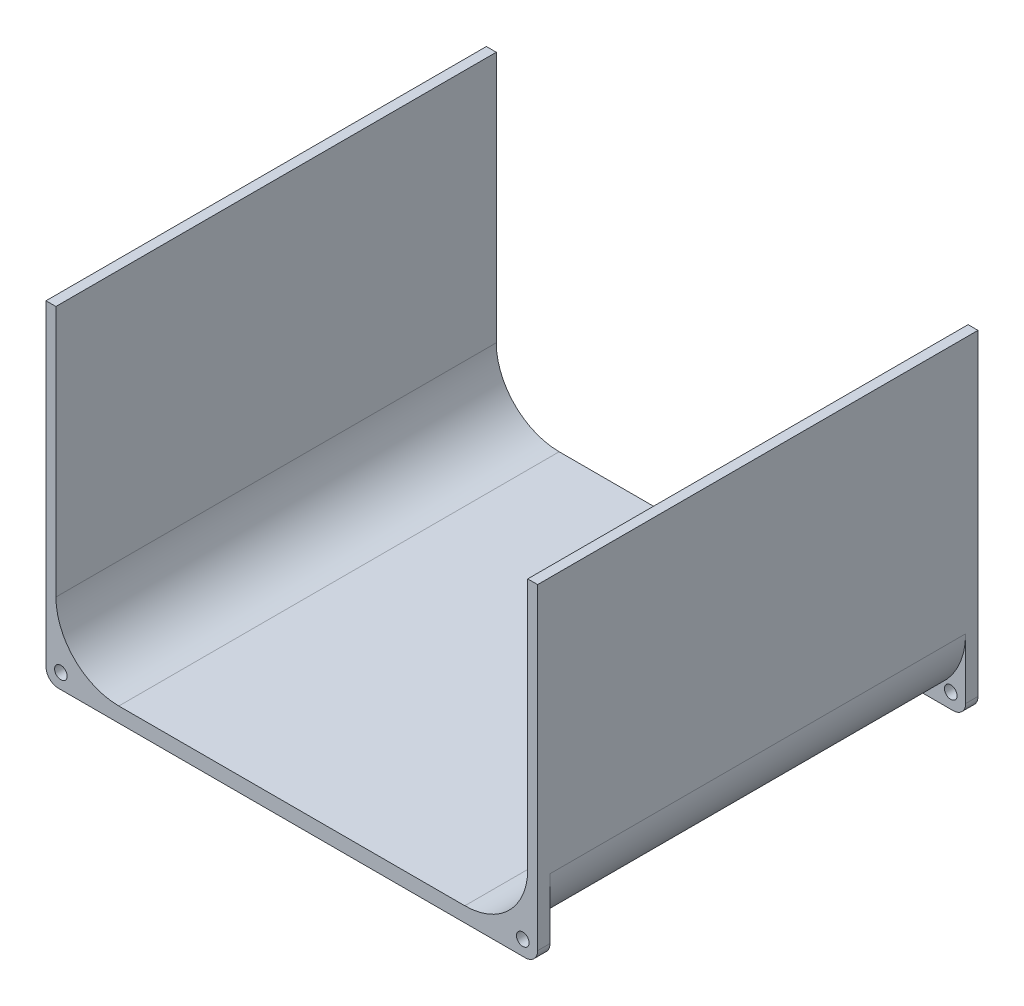
from build123d import *

# Parameters (mm, degrees)
BOSS_EXTRUDE1_DEPTH = 177.8
BOSS_EXTRUDE2_DEPTH = 5
FILLET1_R           = 5
BOSS_EXTRUDE3_DEPTH = 5
FILLET2_R           = 5
BOSS_EXTRUDE4_DEPTH = 5
FILLET3_R           = 5
BOSS_EXTRUDE5_DEPTH = 5
FILLET4_R           = 5
SKETCH6_R           = 2.54
CUT_EXTRUDE1_DEPTH  = 177.8
SKETCH7_R           = 2.54
CUT_EXTRUDE2_DEPTH  = 177.8
SKETCH9_W           = 2.564423076
SKETCH9_H           = 1.234722222
BOSS_EXTRUDE6_DEPTH = 0.8


with BuildPart() as part:
    # Sketch1 → Boss-Extrude1 (new body)
    with BuildSketch(Plane.XY):
        with BuildLine():
            Line((86.99009901, 50.581683168), (90.99009901, 50.581683168))
            Line((90.99009901, 50.581683168), (90.99009901, -53.018316832))
            ThreePointArc((90.99009901, -53.018316832), (82.379038377, -73.807256199), (61.59009901, -82.418316832))
            Line((61.59009901, -82.418316832), (-78.10990099, -82.418316832))
            ThreePointArc((-78.10990099, -82.418316832), (-98.898840357, -73.807256199), (-107.50990099, -53.018316832))
            Line((-107.50990099, -53.018316832), (-107.50990099, 50.581683168))
            Line((-107.50990099, 50.581683168), (-103.50990099, 50.581683168))
            Line((-103.50990099, 50.581683168), (-103.50990099, -51.018316832))
            ThreePointArc((-103.50990099, -51.018316832), (-96.070413232, -68.978829074), (-78.10990099, -76.418316832))
            Line((-78.10990099, -76.418316832), (61.59009901, -76.418316832))
            ThreePointArc((61.59009901, -76.418316832), (79.550611252, -68.978829074), (86.99009901, -51.018316832))
            Line((86.99009901, -51.018316832), (86.99009901, 50.581683168))
        make_face()
    extrude(amount=BOSS_EXTRUDE1_DEPTH)

    # Sketch2 → Boss-Extrude2 (add)
    with BuildSketch(Plane.XY.offset(177.8)):
        Polygon((-107.50990099, -53.018316832), (-101.343905839, -67.718316832), (-91.167595332, -76.919981805), (-78.10990099, -82.418316832), (-107.50990099, -82.418316832), align=None)
    extrude(amount=-BOSS_EXTRUDE2_DEPTH)

    # Fillet1
    fillet1_edges = [part.edges().sort_by_distance(p)[0] for p in [
        (-107.50990099, -82.418316832, 175.3),
    ]]
    fillet(fillet1_edges, radius=FILLET1_R)

    # Sketch3 → Boss-Extrude3 (add)
    with BuildSketch(Plane.XY.offset(177.8)):
        Polygon((90.99009901, -53.018316832), (82.7127388, -69.049550828), (67.334590357, -78.639336426), (61.59009901, -82.418316832), (90.99009901, -82.418316832), align=None)
    extrude(amount=-BOSS_EXTRUDE3_DEPTH)

    # Fillet2
    fillet2_edges = [part.edges().sort_by_distance(p)[0] for p in [
        (90.99009901, -82.418316832, 175.3),
    ]]
    fillet(fillet2_edges, radius=FILLET2_R)

    # Sketch4 → Boss-Extrude4 (add)
    with BuildSketch(Plane(origin=(0, 0, 0), x_dir=(-1, 0, 0), z_dir=(0, 0, -1))):
        Polygon((-90.99009901, -53.018316832), (-84.038583337, -68.805509364), (-61.59009901, -82.418316832), (-90.99009901, -82.418316832), align=None)
    extrude(amount=-BOSS_EXTRUDE4_DEPTH)

    # Fillet3
    fillet3_edges = [part.edges().sort_by_distance(p)[0] for p in [
        (90.99009901, -82.418316832, 2.5),
    ]]
    fillet(fillet3_edges, radius=FILLET3_R)

    # Sketch5 → Boss-Extrude5 (add)
    with BuildSketch(Plane(origin=(0, 0, 0), x_dir=(-1, 0, 0), z_dir=(0, 0, -1))):
        Polygon((107.50990099, -53.018316832), (107.50990099, -82.418316832), (78.10990099, -82.418316832), (97.599794829, -73.133029833), align=None)
    extrude(amount=-BOSS_EXTRUDE5_DEPTH)

    # Fillet4
    fillet4_edges = [part.edges().sort_by_distance(p)[0] for p in [
        (-107.50990099, -82.418316832, 2.5),
    ]]
    fillet(fillet4_edges, radius=FILLET4_R)

    # Sketch6 → Cut-Extrude1 (cut)
    with BuildSketch(Plane(origin=(0, 0, 0), x_dir=(-1, 0, 0), z_dir=(0, 0, -1))):
        with Locations((-84.99009901, -76.418316832)):
            Circle(SKETCH6_R)
    extrude(amount=-CUT_EXTRUDE1_DEPTH, mode=Mode.SUBTRACT)

    # Sketch7 → Cut-Extrude2 (cut)
    with BuildSketch(Plane(origin=(0, 0, 0), x_dir=(-1, 0, 0), z_dir=(0, 0, -1))):
        with Locations((101.50990099, -76.418316832)):
            Circle(SKETCH7_R)
    extrude(amount=-CUT_EXTRUDE2_DEPTH, mode=Mode.SUBTRACT)

    # Sketch9 → Boss-Extrude6 (add)
    # profile 1 of 20: a face of its own
    with BuildSketch(Plane.XZ.offset(82.418316832)):
        with BuildLine():
            Line((-32.637137943, 115.691549017), (-31.307437088, 115.691549017))
            Line((-31.307437088, 115.691549017), (-31.307437088, 110.871383419))
            add(Edge.make_bspline(
                [(-31.307437088, 110.871383419), (-31.307364786, 110.821410033), (-31.307225134, 110.724886954), (-31.300234098, 110.586407937), (-31.293836819, 110.459116726), (-31.28229431, 110.343152678), (-31.265242069, 110.238466187), (-31.248729935, 110.144384785), (-31.226382395, 110.062592892), (-31.192797615, 109.969492304), (-31.141054495, 109.864888709), (-31.056509106, 109.755868442), (-30.95895096, 109.656371625), (-30.842021903, 109.573554244), (-30.710603984, 109.506562447), (-30.565419286, 109.45692894), (-30.406672468, 109.4293393), (-30.296907751, 109.425127236), (-30.240411514, 109.422959274)],
                knots=[0, 0, 0, 0, 1.155499968, 2.231836252, 3.205919964, 4.102923608, 4.924856345, 5.658536265, 6.31071849, 6.882491295, 7.94666036, 8.992281882, 10.060072772, 11.158554251, 12.289267114, 13.461410017, 14.693379945, 16, 16, 16, 16], degree=3))
            add(Edge.make_bspline(
                [(-30.240411514, 109.422959274), (-30.180391234, 109.424710709), (-30.063361851, 109.428125711), (-29.895033714, 109.461647653), (-29.73907674, 109.515026065), (-29.59879307, 109.591210663), (-29.47432231, 109.682531256), (-29.36896042, 109.786665348), (-29.285809203, 109.903820636), (-29.231614334, 110.011905311), (-29.201186583, 110.111387841), (-29.178379469, 110.200271708), (-29.161659331, 110.305145871), (-29.146490272, 110.424372497), (-29.137374836, 110.559186542), (-29.127490632, 110.708503815), (-29.123867979, 110.873345984), (-29.123250525, 110.98812868), (-29.122928541, 111.047984314)],
                knots=[0, 0, 0, 0, 1.261321664, 2.459363699, 3.594844139, 4.716940403, 5.803436589, 6.833651888, 7.818396249, 8.814403945, 9.360733334, 10.004355033, 10.743453831, 11.592799886, 12.532235708, 13.585170094, 14.740740724, 16, 16, 16, 16], degree=3))
            Line((-29.122928541, 111.047984314), (-29.122928541, 115.691549017))
            Line((-29.122928541, 115.691549017), (-27.793227686, 115.691549017))
            Line((-27.793227686, 115.691549017), (-27.793227686, 111.272074525))
            add(Edge.make_bspline(
                [(-27.793227686, 111.272074525), (-27.79341234, 111.182536183), (-27.79376741, 111.010362684), (-27.799220214, 110.762937249), (-27.810828248, 110.536953803), (-27.820577657, 110.332346314), (-27.839446103, 110.149390423), (-27.859102597, 109.987304855), (-27.884156491, 109.846664005), (-27.921435177, 109.686561488), (-27.985767154, 109.502209304), (-28.089478735, 109.289935756), (-28.221133874, 109.082107094), (-28.376743669, 108.881009577), (-28.552441362, 108.694196464), (-28.744331358, 108.530198732), (-28.949365003, 108.391474336), (-29.169684751, 108.281415253), (-29.4051031, 108.195577465), (-29.657949337, 108.137898795), (-29.928051041, 108.098930362), (-30.114615394, 108.095186964), (-30.210730691, 108.093258419)],
                knots=[0, 0, 0, 0, 1.170808336, 2.251350247, 3.235597562, 4.129743112, 4.929140599, 5.639994148, 6.264258765, 6.79612947, 7.788252245, 8.809469599, 9.879094798, 10.999557536, 12.129761673, 13.226370002, 14.293821979, 15.358369427, 16.438775801, 17.562147481, 18.744053101, 20, 20, 20, 20], degree=3))
            add(Edge.make_bspline(
                [(-30.210730691, 108.093258419), (-30.274591607, 108.094334072), (-30.400587884, 108.096456313), (-30.585887512, 108.115168934), (-30.765016003, 108.142744301), (-30.937636775, 108.182973922), (-31.104348963, 108.234943078), (-31.265108275, 108.298913491), (-31.41931729, 108.37452834), (-31.566113077, 108.461092133), (-31.705314991, 108.554695974), (-31.832538355, 108.658459772), (-31.952161224, 108.764709803), (-32.060727742, 108.877917518), (-32.159053341, 108.996894429), (-32.24693552, 109.121910178), (-32.324243714, 109.25295366), (-32.392922569, 109.392386926), (-32.451704966, 109.547296866), (-32.501260734, 109.723193689), (-32.54455382, 109.922834404), (-32.576726687, 110.146668789), (-32.605894797, 110.393959112), (-32.624356602, 110.665349602), (-32.634014804, 110.960848045), (-32.636070591, 111.165710989), (-32.637137943, 111.272074525)],
                knots=[0, 0, 0, 0, 1.001158378, 1.975264943, 2.917723546, 3.841610987, 4.75185031, 5.653588123, 6.552117133, 7.442167995, 8.324307438, 9.179605724, 10.014504199, 10.831958861, 11.636465792, 12.43274043, 13.225645099, 14.020104002, 14.867201867, 15.819789774, 16.883317127, 18.068162734, 19.364263498, 20.787406516, 22.332041935, 24, 24, 24, 24], degree=3))
            Line((-32.637137943, 111.272074525), (-32.637137943, 115.691549017))
        make_face()
    # profile 2 of 20: a face of its own
    with BuildSketch(Plane.XZ.offset(82.418316832)):
        Polygon((-26.843441362, 115.691549017), (-22.854338798, 115.691549017), (-22.854338798, 114.361848163), (-24.184039652, 114.361848163), (-24.184039652, 108.283215684), (-25.513740507, 108.283215684), (-25.513740507, 114.361848163), (-26.843441362, 114.361848163), align=None)
    # profile 3 of 20: a face of its own
    with BuildSketch(Plane.XZ.offset(82.418316832)):
        Polygon((-19.52860262, 115.691549017), (-18.295364439, 115.691549017), (-15.303537515, 108.283215684), (-16.723764879, 108.283215684), (-17.299572839, 109.802873804), (-20.527362302, 109.802873804), (-21.103170261, 108.283215684), (-22.521913584, 108.283215684), align=None)
        Polygon((-18.91272555, 113.704417941), (-20.022788317, 111.132574658), (-17.802662783, 111.132574658), align=None, mode=Mode.SUBTRACT)
    # profile 4 of 20: a face of its own
    with BuildSketch(Plane.XZ.offset(82.418316832)):
        Polygon((-14.971112302, 115.691549017), (-10.982009738, 115.691549017), (-10.982009738, 114.361848163), (-12.311710592, 114.361848163), (-12.311710592, 108.283215684), (-13.641411447, 108.283215684), (-13.641411447, 114.361848163), (-14.971112302, 114.361848163), align=None)
    # profile 5 of 20: a face of its own
    with BuildSketch(Plane.XZ.offset(82.418316832)):
        with Locations((-8.655033242, 110.99010671)):
            Rectangle(SKETCH9_W, SKETCH9_H)
    # profile 6 of 20: a face of its own
    with BuildSketch(Plane.XZ.offset(82.418316832)):
        with BuildLine():
            Line((-5.663206319, 115.691549017), (-4.333505464, 115.691549017))
            Line((-4.333505464, 115.691549017), (-4.333505464, 110.871383419))
            add(Edge.make_bspline(
                [(-4.333505464, 110.871383419), (-4.333433162, 110.821410033), (-4.33329351, 110.724886954), (-4.326302474, 110.586407937), (-4.319905195, 110.459116726), (-4.308362686, 110.343152678), (-4.291310445, 110.238466187), (-4.274798311, 110.144384785), (-4.252450771, 110.062592892), (-4.218865991, 109.969492304), (-4.167122871, 109.864888709), (-4.082577482, 109.755868442), (-3.985019336, 109.656371625), (-3.868090279, 109.573554244), (-3.73667236, 109.506562447), (-3.591487662, 109.45692894), (-3.432740844, 109.4293393), (-3.322976127, 109.425127236), (-3.26647989, 109.422959274)],
                knots=[0, 0, 0, 0, 1.155499968, 2.231836252, 3.205919964, 4.102923608, 4.924856345, 5.658536265, 6.31071849, 6.882491295, 7.94666036, 8.992281882, 10.060072772, 11.158554251, 12.289267114, 13.461410017, 14.693379945, 16, 16, 16, 16], degree=3))
            add(Edge.make_bspline(
                [(-3.26647989, 109.422959274), (-3.20645961, 109.424710709), (-3.089430227, 109.428125711), (-2.92110209, 109.461647653), (-2.765145116, 109.515026065), (-2.624861446, 109.591210663), (-2.500390686, 109.682531256), (-2.395028796, 109.786665348), (-2.311877579, 109.903820636), (-2.25768271, 110.011905311), (-2.22725496, 110.111387841), (-2.204447845, 110.200271708), (-2.187727707, 110.305145871), (-2.172558648, 110.424372497), (-2.163443212, 110.559186542), (-2.153559008, 110.708503815), (-2.149936356, 110.873345984), (-2.149318901, 110.98812868), (-2.148996917, 111.047984314)],
                knots=[0, 0, 0, 0, 1.261321664, 2.459363699, 3.594844139, 4.716940403, 5.803436589, 6.833651888, 7.818396249, 8.814403945, 9.360733334, 10.004355033, 10.743453831, 11.592799886, 12.532235708, 13.585170094, 14.740740724, 16, 16, 16, 16], degree=3))
            Line((-2.148996917, 111.047984314), (-2.148996917, 115.691549017))
            Line((-2.148996917, 115.691549017), (-0.819296063, 115.691549017))
            Line((-0.819296063, 115.691549017), (-0.819296063, 111.272074525))
            add(Edge.make_bspline(
                [(-0.819296063, 111.272074525), (-0.819480716, 111.182536183), (-0.819835786, 111.010362684), (-0.82528859, 110.762937249), (-0.836896624, 110.536953803), (-0.846646033, 110.332346314), (-0.865514479, 110.149390423), (-0.885170973, 109.987304855), (-0.910224867, 109.846664005), (-0.947503553, 109.686561488), (-1.01183553, 109.502209304), (-1.115547111, 109.289935756), (-1.24720225, 109.082107094), (-1.402812045, 108.881009577), (-1.578509738, 108.694196464), (-1.770399734, 108.530198732), (-1.975433379, 108.391474336), (-2.195753127, 108.281415253), (-2.431171476, 108.195577465), (-2.684017713, 108.137898795), (-2.954119417, 108.098930362), (-3.14068377, 108.095186964), (-3.236799067, 108.093258419)],
                knots=[0, 0, 0, 0, 1.170808336, 2.251350247, 3.235597562, 4.129743112, 4.929140599, 5.639994148, 6.264258765, 6.79612947, 7.788252245, 8.809469599, 9.879094798, 10.999557536, 12.129761673, 13.226370002, 14.293821979, 15.358369427, 16.438775801, 17.562147481, 18.744053101, 20, 20, 20, 20], degree=3))
            add(Edge.make_bspline(
                [(-3.236799067, 108.093258419), (-3.300659983, 108.094334072), (-3.42665626, 108.096456313), (-3.611955888, 108.115168934), (-3.791084379, 108.142744301), (-3.963705151, 108.182973922), (-4.130417339, 108.234943078), (-4.291176651, 108.298913491), (-4.445385666, 108.37452834), (-4.592181454, 108.461092133), (-4.731383368, 108.554695974), (-4.858606731, 108.658459772), (-4.9782296, 108.764709803), (-5.086796118, 108.877917518), (-5.185121717, 108.996894429), (-5.273003896, 109.121910178), (-5.35031209, 109.25295366), (-5.418990945, 109.392386926), (-5.477773342, 109.547296866), (-5.52732911, 109.723193689), (-5.570622196, 109.922834404), (-5.602795063, 110.146668789), (-5.631963173, 110.393959112), (-5.650424978, 110.665349602), (-5.66008318, 110.960848045), (-5.662138967, 111.165710989), (-5.663206319, 111.272074525)],
                knots=[0, 0, 0, 0, 1.001158378, 1.975264943, 2.917723546, 3.841610987, 4.75185031, 5.653588123, 6.552117133, 7.442167995, 8.324307438, 9.179605724, 10.014504199, 10.831958861, 11.636465792, 12.43274043, 13.225645099, 14.020104002, 14.867201867, 15.819789774, 16.883317127, 18.068162734, 19.364263498, 20.787406516, 22.332041935, 24, 24, 24, 24], degree=3))
            Line((-5.663206319, 111.272074525), (-5.663206319, 115.691549017))
        make_face()
    # profile 7 of 20: a face of its own
    with BuildSketch(Plane.XZ.offset(82.418316832)):
        Polygon((3.171290543, 115.691549017), (4.404528724, 115.691549017), (7.396355647, 108.283215684), (5.976128283, 108.283215684), (5.400320324, 109.802873804), (2.172530861, 109.802873804), (1.596722901, 108.283215684), (0.177979579, 108.283215684), align=None)
        Polygon((3.787167613, 113.704417941), (2.677104846, 111.132574658), (4.89723038, 111.132574658), align=None, mode=Mode.SUBTRACT)
    # profile 8 of 20: a face of its own
    with BuildSketch(Plane.XZ.offset(82.418316832)):
        Polygon((7.871248809, 115.691549017), (9.291476173, 115.691549017), (11.195500946, 110.429139162), (13.103977842, 115.691549017), (14.519753083, 115.691549017), (11.833638633, 108.283215684), (10.552911136, 108.283215684), align=None)
    # profile 9 of 20: a face of its own
    with BuildSketch(Plane.XZ.offset(82.418316832)):
        Polygon((-44.319509738, 95.220929359), (-43.341526631, 102.629262693), (-43.246547999, 102.629262693), (-40.187939225, 96.550630214), (-37.136750657, 102.629262693), (-37.040287983, 102.629262693), (-36.056368712, 95.220929359), (-36.724187222, 95.220929359), (-37.433558883, 100.551605107), (-40.107801004, 95.220929359), (-40.257689158, 95.220929359), (-42.942319567, 100.563477436), (-43.650207187, 95.220929359), align=None)
    # profile 10 of 20: a face of its own
    with BuildSketch(Plane.XZ.offset(82.418316832)):
        with BuildLine():
            Line((-29.217907174, 100.634711411), (-29.217907174, 95.220929359))
            Line((-29.217907174, 95.220929359), (-29.882757601, 95.220929359))
            Line((-29.882757601, 95.220929359), (-29.882757601, 96.157359314))
            add(Edge.make_bspline(
                [(-29.882757601, 96.157359314), (-29.957727374, 96.07260884), (-30.10403183, 95.907217224), (-30.348382197, 95.691143293), (-30.60739484, 95.512542512), (-30.879812636, 95.368291857), (-31.165389585, 95.259935338), (-31.463492636, 95.182917968), (-31.774243392, 95.133401017), (-31.98644421, 95.128456437), (-32.093978888, 95.125950727)],
                knots=[0, 0, 0, 0, 1.074387032, 2.096679803, 3.090159297, 4.057316773, 5.018401886, 5.985159533, 6.978961417, 8, 8, 8, 8], degree=3))
            add(Edge.make_bspline(
                [(-32.093978888, 95.125950727), (-32.189584391, 95.128546548), (-32.378122674, 95.133665623), (-32.655467554, 95.173379165), (-32.922362816, 95.237155648), (-33.179060661, 95.325845864), (-33.423900036, 95.443491936), (-33.65897724, 95.584337578), (-33.883074438, 95.752064002), (-34.092775862, 95.943808662), (-34.285883597, 96.152078051), (-34.455346624, 96.374212792), (-34.596640643, 96.609252335), (-34.714793147, 96.854220844), (-34.805802076, 97.111004091), (-34.869246268, 97.378714096), (-34.908913547, 97.657034329), (-34.914030506, 97.846559652), (-34.916625122, 97.942660796)],
                knots=[0, 0, 0, 0, 1.033919861, 2.038935746, 3.024066025, 3.998881131, 4.97069526, 5.957263378, 6.95902576, 7.993208707, 9.027059324, 10.027763471, 11.009749337, 11.988697705, 12.965288445, 13.950418724, 14.960734635, 16, 16, 16, 16], degree=3))
            add(Edge.make_bspline(
                [(-34.916625122, 97.942660796), (-34.913973, 98.036775635), (-34.908729896, 98.222835595), (-34.869670581, 98.496475506), (-34.803988279, 98.760039158), (-34.711812001, 99.012678021), (-34.593613197, 99.254697794), (-34.449832079, 99.486269647), (-34.280458265, 99.708031538), (-34.08519067, 99.914768968), (-33.873662074, 100.105735935), (-33.647371926, 100.271701748), (-33.411949314, 100.415035745), (-33.163742609, 100.52860227), (-32.90642557, 100.620484874), (-32.637707443, 100.684054657), (-32.358706268, 100.721513987), (-32.169284727, 100.726938504), (-32.073202313, 100.729690043)],
                knots=[0, 0, 0, 0, 1.020392517, 2.01726096, 2.990465484, 3.961182959, 4.928053699, 5.906110375, 6.912531644, 7.948652711, 8.985773172, 9.998621852, 10.987621588, 11.969261332, 12.953316658, 13.946091881, 14.958173133, 16, 16, 16, 16], degree=3))
            add(Edge.make_bspline(
                [(-32.073202313, 100.729690043), (-31.962712611, 100.726646802), (-31.746047521, 100.720679151), (-31.429123234, 100.671016378), (-31.129309089, 100.587114956), (-30.844290711, 100.472989585), (-30.575091592, 100.321333108), (-30.324260275, 100.130028858), (-30.089171669, 99.900283345), (-29.952900052, 99.723815904), (-29.882757601, 99.632983646)],
                knots=[0, 0, 0, 0, 1.038897134, 2.037228247, 3.008116434, 3.962042015, 4.918381754, 5.904844433, 6.921570401, 8, 8, 8, 8], degree=3))
            Line((-29.882757601, 99.632983646), (-29.882757601, 100.634711411))
            Line((-29.882757601, 100.634711411), (-29.217907174, 100.634711411))
        make_face()
        with BuildLine():
            add(Edge.make_bspline(
                [(-32.064298066, 100.064839616), (-32.161483414, 100.061381749), (-32.353311834, 100.054556471), (-32.634921639, 100.001272572), (-32.904401698, 99.912616848), (-33.160404222, 99.791370157), (-33.398885281, 99.638909331), (-33.612020217, 99.454502403), (-33.801552269, 99.243180723), (-33.960954761, 99.005897923), (-34.09089798, 98.751520963), (-34.182268197, 98.485615903), (-34.242528104, 98.2129787), (-34.248684473, 98.028061015), (-34.251774695, 97.935240591)],
                knots=[0, 0, 0, 0, 1.031046209, 2.035121221, 3.029706178, 4.034933723, 5.034054252, 6.02443088, 7.017295772, 8.038157696, 9.050218397, 10.03989886, 11.016116709, 12, 12, 12, 12], degree=3))
            add(Edge.make_bspline(
                [(-34.251774695, 97.935240591), (-34.247827337, 97.842974864), (-34.239948095, 97.65880506), (-34.183325792, 97.385796173), (-34.08833006, 97.119828451), (-33.958701027, 96.863159348), (-33.796381004, 96.624856335), (-33.608233357, 96.409506409), (-33.392438594, 96.224320114), (-33.153408704, 96.069300583), (-32.898121834, 95.944073247), (-32.629656679, 95.85693931), (-32.353059911, 95.800683008), (-32.164989138, 95.794111865), (-32.07023423, 95.790801154)],
                knots=[0, 0, 0, 0, 0.979072187, 1.954306742, 2.945804271, 3.96968567, 4.997920485, 5.998718438, 6.996577872, 8.005894225, 9.015743152, 10.005417472, 10.995077863, 12, 12, 12, 12], degree=3))
            add(Edge.make_bspline(
                [(-32.07023423, 95.790801154), (-31.974039133, 95.794314744), (-31.782716625, 95.801302927), (-31.50027136, 95.854814939), (-31.226173688, 95.943225562), (-30.964157388, 96.065778713), (-30.720071577, 96.217665117), (-30.50100107, 96.395480126), (-30.315758937, 96.602285199), (-30.158717913, 96.829565358), (-30.035579948, 97.078722417), (-29.945883956, 97.344013121), (-29.892853189, 97.625446705), (-29.886169327, 97.81777535), (-29.882757601, 97.915948056)],
                knots=[0, 0, 0, 0, 1.01762866, 2.023962475, 3.030623092, 4.058876274, 5.077231937, 6.066672613, 7.034107872, 8.005628644, 8.981990164, 9.965428785, 10.961468474, 12, 12, 12, 12], degree=3))
            add(Edge.make_bspline(
                [(-29.882757601, 97.915948056), (-29.884788874, 97.990746464), (-29.888787061, 98.137973401), (-29.919331767, 98.354143313), (-29.967919694, 98.561013033), (-30.036385754, 98.758800058), (-30.126325639, 98.946410841), (-30.234800077, 99.125192467), (-30.363716612, 99.294215098), (-30.510999986, 99.451151264), (-30.672216331, 99.594293943), (-30.842808109, 99.722064919), (-31.024796457, 99.827027821), (-31.215120851, 99.913898513), (-31.414111509, 99.983027047), (-31.623387655, 100.029144332), (-31.840724844, 100.060810345), (-31.988988994, 100.063482384), (-32.064298066, 100.064839616)],
                knots=[0, 0, 0, 0, 1.050140795, 2.067009409, 3.05949893, 4.030605086, 5.00011959, 5.97591094, 6.962425594, 7.979863591, 8.993523472, 9.986985069, 10.967611495, 11.937549037, 12.921786183, 13.919465291, 14.943216303, 16, 16, 16, 16], degree=3))
        make_face(mode=Mode.SUBTRACT)
    # profile 11 of 20: a face of its own
    with BuildSketch(Plane.XZ.offset(82.418316832)):
        Polygon((-28.173142216, 100.634711411), (-27.382148293, 100.634711411), (-25.988633669, 98.68171328), (-24.595119046, 100.634711411), (-23.804125122, 100.634711411), (-25.592394687, 98.128165938), (-23.519189225, 95.220929359), (-24.310183149, 95.220929359), (-25.988633669, 97.573134554), (-27.66708419, 95.220929359), (-28.458078114, 95.220929359), (-26.383388611, 98.128165938), align=None)
    # profile 12 of 20: a face of its own
    with BuildSketch(Plane.XZ.offset(82.418316832)):
        Polygon((-23.424210592, 101.869433633), (-23.424210592, 102.629262693), (-19.530086661, 102.629262693), (-19.530086661, 101.869433633), (-21.144723413, 101.869433633), (-21.144723413, 95.220929359), (-21.80957384, 95.220929359), (-21.80957384, 101.869433633), align=None)
    # profile 13 of 20: a face of its own
    with BuildSketch(Plane.XZ.offset(82.418316832)):
        with BuildLine():
            Line((-14.137081185, 96.930544744), (-13.546432815, 96.620380147))
            add(Edge.make_bspline(
                [(-13.546432815, 96.620380147), (-13.593500275, 96.536891763), (-13.685074913, 96.374456428), (-13.842556496, 96.151292324), (-14.007639716, 95.950531325), (-14.187776448, 95.77753689), (-14.377577269, 95.626721459), (-14.578094721, 95.494773063), (-14.790372719, 95.382338862), (-15.014421303, 95.287612678), (-15.252122019, 95.214779248), (-15.504050896, 95.163335314), (-15.770690561, 95.131536062), (-15.953456642, 95.127842181), (-16.047042123, 95.125950727)],
                knots=[0, 0, 0, 0, 1.120438281, 2.179929193, 3.190490725, 4.156257408, 5.095198341, 6.022838206, 6.959905092, 7.901321166, 8.864066838, 9.862729781, 10.905609505, 12, 12, 12, 12], degree=3))
            add(Edge.make_bspline(
                [(-16.047042123, 95.125950727), (-16.151059309, 95.128378915), (-16.353966704, 95.133115605), (-16.649325836, 95.173951322), (-16.927412271, 95.240567814), (-17.188210377, 95.333628211), (-17.431081478, 95.455182713), (-17.656508287, 95.603263616), (-17.865676284, 95.777110222), (-18.051994193, 95.978228361), (-18.219727078, 96.19345517), (-18.36773673, 96.417728459), (-18.491471626, 96.650483951), (-18.592124651, 96.890239894), (-18.673414949, 97.135485135), (-18.730071138, 97.388451075), (-18.762730771, 97.648453061), (-18.767735515, 97.824342422), (-18.770257601, 97.912979974)],
                knots=[0, 0, 0, 0, 1.145258523, 2.234067595, 3.276747158, 4.290159414, 5.277019952, 6.260822364, 7.254936242, 8.264827045, 9.274100331, 10.257902744, 11.220704747, 12.172965371, 13.118907548, 14.062713208, 15.023725156, 16, 16, 16, 16], degree=3))
            add(Edge.make_bspline(
                [(-18.770257601, 97.912979974), (-18.768015752, 97.996154031), (-18.763572703, 98.16099403), (-18.735567536, 98.404972766), (-18.685935316, 98.642099657), (-18.617828764, 98.872571739), (-18.529878626, 99.096003122), (-18.422283762, 99.31252979), (-18.294876562, 99.521921336), (-18.196509403, 99.654007969), (-18.146960325, 99.720542073)],
                knots=[0, 0, 0, 0, 1.024358464, 2.0301432, 3.019427413, 4.004406732, 4.986367066, 5.972626655, 6.978780325, 8, 8, 8, 8], degree=3))
            add(Edge.make_bspline(
                [(-18.146960325, 99.720542073), (-18.07984573, 99.800697848), (-17.94774256, 99.958470266), (-17.724314941, 100.165773056), (-17.482379525, 100.33943238), (-17.22496825, 100.483380818), (-16.94908938, 100.592756704), (-16.658451381, 100.67426442), (-16.34974489, 100.719937877), (-16.138702172, 100.726389125), (-16.03071767, 100.729690043)],
                knots=[0, 0, 0, 0, 1.030682036, 2.02871468, 2.997146059, 3.962720338, 4.930598197, 5.918074684, 6.934738563, 8, 8, 8, 8], degree=3))
            add(Edge.make_bspline(
                [(-16.03071767, 100.729690043), (-15.919703573, 100.726823973), (-15.701919219, 100.721201397), (-15.384351229, 100.669075657), (-15.083867712, 100.586414417), (-14.800588912, 100.469672227), (-14.534486106, 100.319051176), (-14.287288968, 100.132484278), (-14.054769933, 99.915699327), (-13.919496775, 99.748983867), (-13.850661247, 99.66414851)],
                knots=[0, 0, 0, 0, 1.056321875, 2.072262726, 3.055038591, 4.01806755, 4.982017516, 5.957941055, 6.960871419, 8, 8, 8, 8], degree=3))
            add(Edge.make_bspline(
                [(-13.850661247, 99.66414851), (-13.803825894, 99.600217596), (-13.710466939, 99.472781311), (-13.593527244, 99.264985696), (-13.492017424, 99.047581604), (-13.410879323, 98.817054809), (-13.345179046, 98.576136697), (-13.297645446, 98.323104978), (-13.269769754, 98.058034999), (-13.264290344, 97.877427123), (-13.261496917, 97.785352436)],
                knots=[0, 0, 0, 0, 0.94817472, 1.890038105, 2.849395472, 3.817997239, 4.812318967, 5.836947057, 6.897266129, 8, 8, 8, 8], degree=3))
            Line((-13.261496917, 97.785352436), (-18.105407174, 97.785352436))
            add(Edge.make_bspline(
                [(-18.105407174, 97.785352436), (-18.10214834, 97.714019787), (-18.095739975, 97.573747009), (-18.065862922, 97.368492185), (-18.018769684, 97.17296861), (-17.952583502, 96.988642838), (-17.872432013, 96.813107402), (-17.774248912, 96.647664423), (-17.657113523, 96.493067472), (-17.526460792, 96.347933697), (-17.381030774, 96.218688419), (-17.228032292, 96.103008826), (-17.065274247, 96.006053646), (-16.89403997, 95.927356213), (-16.714606358, 95.865747844), (-16.526916878, 95.82369429), (-16.331340865, 95.795527581), (-16.198021062, 95.792395623), (-16.130148426, 95.790801154)],
                knots=[0, 0, 0, 0, 1.094153842, 2.151609401, 3.174256925, 4.172055639, 5.149267565, 6.128595816, 7.11444997, 8.118368179, 9.117203808, 10.09244225, 11.054858984, 12.015122123, 12.976791628, 13.957293641, 14.960065497, 16, 16, 16, 16], degree=3))
            add(Edge.make_bspline(
                [(-16.130148426, 95.790801154), (-16.063788497, 95.792088207), (-15.932117668, 95.794641968), (-15.736027853, 95.819474513), (-15.543115854, 95.859628263), (-15.354180106, 95.914428742), (-15.173055149, 95.981266412), (-15.005318734, 96.061917461), (-14.851055611, 96.151134425), (-14.706874699, 96.253178237), (-14.567024429, 96.378078899), (-14.428292833, 96.533941175), (-14.279540583, 96.718276443), (-14.186429279, 96.857014769), (-14.137081185, 96.930544744)],
                knots=[0, 0, 0, 0, 0.99110716, 1.966546729, 2.947904876, 3.932708344, 4.903319531, 5.828989031, 6.710028674, 7.56322171, 8.463672341, 9.504779593, 10.677557249, 12, 12, 12, 12], degree=3))
        make_face()
        with BuildLine():
            add(Edge.make_bspline(
                [(-13.926347345, 98.450202864), (-13.950681867, 98.53838928), (-13.997517988, 98.708119743), (-14.095384959, 98.943156295), (-14.205603054, 99.152045685), (-14.336035719, 99.333189242), (-14.483818688, 99.494063344), (-14.654517658, 99.634649349), (-14.845940299, 99.760416288), (-15.057097147, 99.866572411), (-15.280705592, 99.956932612), (-15.514822032, 100.017522441), (-15.753704349, 100.059029305), (-15.915278589, 100.062894568), (-15.996584724, 100.064839616)],
                knots=[0, 0, 0, 0, 1.154881502, 2.222775134, 3.210006277, 4.132804581, 5.035138423, 5.962687519, 6.919655026, 7.923214229, 8.944639381, 9.960483929, 10.97369054, 12, 12, 12, 12], degree=3))
            add(Edge.make_bspline(
                [(-15.996584724, 100.064839616), (-16.062941036, 100.063544911), (-16.194113513, 100.060985552), (-16.387367441, 100.036707111), (-16.572956137, 99.99657544), (-16.752248996, 99.941616282), (-16.9228965, 99.868361406), (-17.08840876, 99.782460243), (-17.244577265, 99.677597224), (-17.342243007, 99.597674315), (-17.391583389, 99.557297548)],
                knots=[0, 0, 0, 0, 1.04873581, 2.073130211, 3.073294108, 4.04793562, 5.032784715, 6.005352987, 6.992311501, 8, 8, 8, 8], degree=3))
            add(Edge.make_bspline(
                [(-17.391583389, 99.557297548), (-17.426917502, 99.525347914), (-17.498425137, 99.46068964), (-17.593972574, 99.349291152), (-17.685455908, 99.229167013), (-17.768712139, 99.095721499), (-17.845076364, 98.950474183), (-17.916534982, 98.794650189), (-17.980852888, 98.627067063), (-18.017039654, 98.5102854), (-18.03565724, 98.450202864)],
                knots=[0, 0, 0, 0, 0.879870761, 1.780643979, 2.707998968, 3.669668524, 4.684282772, 5.740141944, 6.837334558, 8, 8, 8, 8], degree=3))
            Line((-18.03565724, 98.450202864), (-13.926347345, 98.450202864))
        make_face(mode=Mode.SUBTRACT)
    # profile 14 of 20: a face of its own
    with BuildSketch(Plane.XZ.offset(82.418316832)):
        with BuildLine():
            Line((-11.931796063, 100.634711411), (-11.266945635, 100.634711411))
            Line((-11.266945635, 100.634711411), (-11.266945635, 99.693829333))
            add(Edge.make_bspline(
                [(-11.266945635, 99.693829333), (-11.207077941, 99.776141423), (-11.0923657, 99.933859279), (-10.904266736, 100.141695381), (-10.716357297, 100.318073308), (-10.581031639, 100.410662386), (-10.516020822, 100.455142433)],
                knots=[0, 0, 0, 0, 1.134379233, 2.173579362, 3.122582517, 4, 4, 4, 4], degree=3))
            add(Edge.make_bspline(
                [(-10.516020822, 100.455142433), (-10.427407287, 100.497487123), (-10.251728399, 100.581436692), (-9.973557707, 100.666597725), (-9.688919656, 100.718932522), (-9.496708937, 100.726089763), (-9.40002189, 100.729690043)],
                knots=[0, 0, 0, 0, 1.014936303, 2.012140481, 3.000054389, 4, 4, 4, 4], degree=3))
            add(Edge.make_bspline(
                [(-9.40002189, 100.729690043), (-9.334631714, 100.727477511), (-9.205228072, 100.723099029), (-9.013491748, 100.694608621), (-8.827524353, 100.645361888), (-8.648424658, 100.576766386), (-8.479682553, 100.493694232), (-8.324977085, 100.39622235), (-8.186072511, 100.286796874), (-8.063039035, 100.160476465), (-7.952402932, 100.013713999), (-7.85063604, 99.842551338), (-7.756602673, 99.643145123), (-7.70448757, 99.498435944), (-7.677050136, 99.422249805)],
                knots=[0, 0, 0, 0, 1.009824226, 1.998387844, 2.986035974, 3.974953746, 4.955485308, 5.885931332, 6.793869504, 7.679848016, 8.601185859, 9.625726857, 10.749998409, 12, 12, 12, 12], degree=3))
            add(Edge.make_bspline(
                [(-7.677050136, 99.422249805), (-7.648027987, 99.474583159), (-7.590916474, 99.577567851), (-7.495019542, 99.723317839), (-7.39454604, 99.859645549), (-7.288639696, 99.986659147), (-7.177674321, 100.10373141), (-7.06112769, 100.211249402), (-6.939663236, 100.309674854), (-6.770769661, 100.424658875), (-6.551032976, 100.546793042), (-6.273986466, 100.652686582), (-5.985801937, 100.71812572), (-5.790184475, 100.725809798), (-5.6914031, 100.729690043)],
                knots=[0, 0, 0, 0, 0.86119277, 1.694706429, 2.50939023, 3.298075842, 4.073795165, 4.829715201, 5.57930267, 6.321991688, 7.768977793, 9.186738141, 10.579381044, 12, 12, 12, 12], degree=3))
            add(Edge.make_bspline(
                [(-5.6914031, 100.729690043), (-5.600637337, 100.726266926), (-5.422999927, 100.719567552), (-5.164391381, 100.666961034), (-4.92321456, 100.576626681), (-4.699954748, 100.453365483), (-4.498533143, 100.298469545), (-4.323450289, 100.114173839), (-4.175769687, 99.901781954), (-4.079294899, 99.701985577), (-4.01385759, 99.525592456), (-3.973511311, 99.375295806), (-3.937867289, 99.209875019), (-3.908273653, 99.029132299), (-3.886644385, 98.832429178), (-3.870619704, 98.620087558), (-3.859773748, 98.391942405), (-3.859007362, 98.234535429), (-3.858612302, 98.153394637)],
                knots=[0, 0, 0, 0, 1.209669288, 2.367440248, 3.500751976, 4.631527125, 5.755587489, 6.87532382, 8.007944318, 9.190864318, 9.82315674, 10.514484317, 11.263564316, 12.079023757, 12.955305781, 13.901327259, 14.918167583, 16, 16, 16, 16], degree=3))
            Line((-3.858612302, 98.153394637), (-3.858612302, 95.220929359))
            Line((-3.858612302, 95.220929359), (-4.523462729, 95.220929359))
            Line((-4.523462729, 95.220929359), (-4.523462729, 98.156362719))
            add(Edge.make_bspline(
                [(-4.523462729, 98.156362719), (-4.523627581, 98.225621267), (-4.523944403, 98.358725664), (-4.529645923, 98.549760019), (-4.540388671, 98.723894709), (-4.552950323, 98.880892295), (-4.570399719, 99.021118897), (-4.592933608, 99.14429285), (-4.616804697, 99.251383084), (-4.656462545, 99.370098551), (-4.719852249, 99.501057164), (-4.816409248, 99.642288732), (-4.938054307, 99.765226426), (-5.078516638, 99.871945197), (-5.238427513, 99.95871507), (-5.414671177, 100.020682624), (-5.606153419, 100.059042717), (-5.738704988, 100.06286545), (-5.807158309, 100.064839616)],
                knots=[0, 0, 0, 0, 1.253487763, 2.409012846, 3.458416907, 4.410876679, 5.259312806, 6.014470957, 6.676830364, 7.243083969, 8.276244668, 9.299465089, 10.325150304, 11.392391894, 12.482080715, 13.603491619, 14.762376348, 16, 16, 16, 16], degree=3))
            add(Edge.make_bspline(
                [(-5.807158309, 100.064839616), (-5.891126379, 100.061842083), (-6.057079208, 100.055917817), (-6.299322153, 99.995436453), (-6.532094138, 99.904249922), (-6.748449503, 99.772101222), (-6.947474993, 99.613756851), (-7.118712433, 99.425480207), (-7.260173893, 99.212480195), (-7.355961475, 99.015319675), (-7.416475496, 98.838219352), (-7.456431634, 98.683496582), (-7.48751148, 98.507640596), (-7.5166591, 98.311833074), (-7.535683124, 98.094726192), (-7.552972845, 97.857324243), (-7.561060338, 97.598913196), (-7.562191609, 97.419786705), (-7.562778968, 97.326783726)],
                knots=[0, 0, 0, 0, 1.090531906, 2.155305635, 3.229839962, 4.33261226, 5.44038871, 6.529323825, 7.629011124, 8.757537029, 9.370236727, 10.061839251, 10.834451254, 11.692844982, 12.636905849, 13.66920014, 14.789842145, 16, 16, 16, 16], degree=3))
            Line((-7.562778968, 97.326783726), (-7.562778968, 95.220929359))
            Line((-7.562778968, 95.220929359), (-8.227629396, 95.220929359))
            Line((-8.227629396, 95.220929359), (-8.227629396, 97.97382566))
            add(Edge.make_bspline(
                [(-8.227629396, 97.97382566), (-8.227797525, 98.051493185), (-8.228120988, 98.200917696), (-8.233785859, 98.415195642), (-8.244552542, 98.610100595), (-8.256999703, 98.785406026), (-8.274907081, 98.940793339), (-8.295247744, 99.077095577), (-8.319268969, 99.193971033), (-8.359040892, 99.322163531), (-8.41981985, 99.463389485), (-8.517585004, 99.613971313), (-8.639521049, 99.745772119), (-8.78254607, 99.85829147), (-8.943424764, 99.951300939), (-9.121189629, 100.01831408), (-9.314240028, 100.05731216), (-9.447331172, 100.062283145), (-9.515777099, 100.064839616)],
                knots=[0, 0, 0, 0, 1.320475261, 2.540461679, 3.643808994, 4.639130445, 5.527981419, 6.302341397, 6.981980563, 7.553956391, 8.582137848, 9.585246428, 10.591171744, 11.620968678, 12.668337649, 13.738356861, 14.836885341, 16, 16, 16, 16], degree=3))
            add(Edge.make_bspline(
                [(-9.515777099, 100.064839616), (-9.596244746, 100.061600142), (-9.75661391, 100.055143986), (-9.99220308, 99.99703244), (-10.219714443, 99.906007148), (-10.435518556, 99.779727198), (-10.633795503, 99.623307481), (-10.807379669, 99.439337619), (-10.953308014, 99.230107164), (-11.050107023, 99.035025604), (-11.11254546, 98.862362172), (-11.154022251, 98.715569333), (-11.189666126, 98.552585474), (-11.216154138, 98.372907756), (-11.241724352, 98.17770644), (-11.254065172, 97.966009103), (-11.266069979, 97.737997351), (-11.26664659, 97.580575464), (-11.266945635, 97.498932498)],
                knots=[0, 0, 0, 0, 1.098833095, 2.189935336, 3.297829714, 4.440610912, 5.596351641, 6.740013378, 7.886572111, 9.072425424, 9.705826452, 10.395263256, 11.156850408, 11.985370555, 12.878090359, 13.847760091, 14.883794034, 16, 16, 16, 16], degree=3))
            Line((-11.266945635, 97.498932498), (-11.266945635, 95.220929359))
            Line((-11.266945635, 95.220929359), (-11.931796063, 95.220929359))
            Line((-11.931796063, 95.220929359), (-11.931796063, 100.634711411))
        make_face()
    # profile 15 of 20: a face of its own
    with BuildSketch(Plane.XZ.offset(82.418316832)):
        with BuildLine():
            Line((-2.338954182, 100.634711411), (-1.674103755, 100.634711411))
            Line((-1.674103755, 100.634711411), (-1.674103755, 99.632983646))
            add(Edge.make_bspline(
                [(-1.674103755, 99.632983646), (-1.60349708, 99.723868516), (-1.466287138, 99.900485073), (-1.229802756, 100.129064178), (-0.980191011, 100.321840238), (-0.711028454, 100.472933266), (-0.42649831, 100.586853984), (-0.127768238, 100.67105382), (0.187697147, 100.720671608), (0.403377972, 100.726644124), (0.513372874, 100.729690043)],
                knots=[0, 0, 0, 0, 1.0828784, 2.104357462, 3.088488658, 4.04616522, 5.001424249, 5.969181776, 6.964304535, 8, 8, 8, 8], degree=3))
            add(Edge.make_bspline(
                [(0.513372874, 100.729690043), (0.609451768, 100.726910481), (0.799356748, 100.721416531), (1.078890583, 100.684220232), (1.348078478, 100.620471116), (1.605397525, 100.528605845), (1.853604347, 100.415035101), (2.089024458, 100.271700709), (2.315324817, 100.105740938), (2.526814084, 99.914749552), (2.722227646, 99.708103055), (2.891235396, 99.485805845), (3.03701426, 99.25516837), (3.154849721, 99.012615108), (3.247154056, 98.760056072), (3.31280179, 98.496470872), (3.351870469, 98.222836798), (3.357112292, 98.036776039), (3.359763767, 97.942660796)],
                knots=[0, 0, 0, 0, 1.041296284, 2.058176809, 3.050446431, 4.034000596, 5.01514041, 6.003636468, 7.015969324, 8.052561599, 9.08815499, 10.094063707, 11.074456064, 12.040834395, 13.011057502, 13.983766392, 14.980127149, 16, 16, 16, 16], degree=3))
            add(Edge.make_bspline(
                [(3.359763767, 97.942660796), (3.357169822, 97.846559243), (3.352054189, 97.657033112), (3.31237726, 97.378718756), (3.248968543, 97.110987148), (3.157828722, 96.854283607), (3.040054239, 96.608784878), (2.896746252, 96.374668007), (2.72765323, 96.152008002), (2.534399177, 95.943827697), (2.324737129, 95.752059151), (2.100629776, 95.58433857), (1.86555505, 95.443492659), (1.62071563, 95.325842061), (1.364015528, 95.237170272), (1.096652424, 95.17320926), (0.81877188, 95.133766245), (0.629751109, 95.128575876), (0.53414945, 95.125950727)],
                knots=[0, 0, 0, 0, 1.038740735, 2.04854663, 3.033179607, 4.009277356, 4.987731542, 5.972001279, 6.972200261, 8.005528982, 9.039189865, 10.040446548, 11.026516639, 11.997840187, 12.972163198, 13.956796175, 14.96660207, 16, 16, 16, 16], degree=3))
            add(Edge.make_bspline(
                [(0.53414945, 95.125950727), (0.426564423, 95.128691403), (0.214052453, 95.134105042), (-0.096669283, 95.188967794), (-0.395705286, 95.270960974), (-0.679742532, 95.390973844), (-0.951031068, 95.543914686), (-1.208036324, 95.730414622), (-1.452123451, 95.950083611), (-1.599038654, 96.116732622), (-1.674103755, 96.201880548)],
                knots=[0, 0, 0, 0, 1.014726462, 2.004382257, 2.969841629, 3.936926163, 4.907207904, 5.903978561, 6.929055279, 8, 8, 8, 8], degree=3))
            Line((-1.674103755, 96.201880548), (-1.674103755, 93.226378077))
            Line((-1.674103755, 93.226378077), (-2.338954182, 93.226378077))
            Line((-2.338954182, 93.226378077), (-2.338954182, 100.634711411))
        make_face()
        with BuildLine():
            add(Edge.make_bspline(
                [(0.50743671, 100.064839616), (0.432126636, 100.063484402), (0.283860512, 100.060816337), (0.066537648, 100.029121479), (-0.142791007, 99.983109926), (-0.342015804, 99.913446404), (-0.533046276, 99.827935583), (-0.714411091, 99.721081993), (-0.885982942, 99.59481858), (-1.047330157, 99.451563969), (-1.193090795, 99.293714213), (-1.322128992, 99.12525335), (-1.430517788, 98.946394721), (-1.520480398, 98.75880437), (-1.588940346, 98.56101185), (-1.637529953, 98.35414364), (-1.668074199, 98.137973315), (-1.67207245, 97.990746435), (-1.674103755, 97.915948056)],
                knots=[0, 0, 0, 0, 1.05670511, 2.080379991, 3.077984906, 4.06214886, 5.038337365, 6.01289324, 7.01187578, 8.025460281, 9.038092164, 10.024533457, 11.000252242, 11.969694649, 12.940728589, 13.933144304, 14.949937299, 16, 16, 16, 16], degree=3))
            add(Edge.make_bspline(
                [(-1.674103755, 97.915948056), (-1.670736443, 97.817759884), (-1.664139593, 97.62540094), (-1.610508831, 97.344341216), (-1.523227522, 97.078378545), (-1.399341745, 96.829752683), (-1.242819379, 96.601189016), (-1.054228282, 96.396527232), (-0.835274882, 96.217053814), (-0.589599326, 96.065878827), (-0.32623915, 95.94313742), (-0.051525636, 95.855265675), (0.230763362, 95.801137791), (0.421619639, 95.794265357), (0.517824998, 95.790801154)],
                knots=[0, 0, 0, 0, 1.03728447, 2.032128127, 3.01272805, 3.987917167, 4.958271349, 5.931593992, 6.91984656, 7.941419022, 8.973179163, 9.983609215, 10.983593296, 12, 12, 12, 12], degree=3))
            add(Edge.make_bspline(
                [(0.517824998, 95.790801154), (0.612092373, 95.794095485), (0.799196167, 95.80063414), (1.074697524, 95.857229971), (1.342436042, 95.943685272), (1.596817407, 96.069753), (1.835627123, 96.224248623), (2.051276411, 96.409584027), (2.239674378, 96.624404406), (2.40025393, 96.863605738), (2.529648907, 97.120093633), (2.626867915, 97.385484239), (2.682977728, 97.658842051), (2.690929597, 97.84298721), (2.694913339, 97.935240591)],
                knots=[0, 0, 0, 0, 1.00104056, 1.986885549, 2.97790532, 3.984399681, 4.995088187, 5.994304198, 6.996462723, 8.023150851, 9.048424203, 10.043036403, 11.019596776, 12, 12, 12, 12], degree=3))
            add(Edge.make_bspline(
                [(2.694913339, 97.935240591), (2.691834153, 98.028066984), (2.685699769, 98.21299656), (2.625275206, 98.485544705), (2.534470253, 98.752007588), (2.402053593, 99.004992751), (2.24499424, 99.243697893), (2.055029763, 99.45442027), (1.842058814, 99.638931527), (1.603533417, 99.791364145), (1.347542849, 99.912618443), (1.078059611, 100.001272145), (0.796450652, 100.054556581), (0.604622117, 100.061381786), (0.50743671, 100.064839616)],
                knots=[0, 0, 0, 0, 0.983928682, 1.960191568, 2.949917689, 3.96440592, 4.982380491, 5.975291189, 6.965713506, 7.964880129, 8.970154049, 9.96478489, 10.968906225, 12, 12, 12, 12], degree=3))
        make_face(mode=Mode.SUBTRACT)
    # profile 16 of 20: a face of its own
    with BuildSketch(Plane.XZ.offset(82.418316832)):
        with BuildLine():
            add(Edge.make_bspline(
                [(5.401804365, 100.729690043), (5.443058647, 100.72723859), (5.523932845, 100.722432804), (5.640855667, 100.689462177), (5.746677696, 100.630918013), (5.840937614, 100.552891799), (5.91863299, 100.458285978), (5.979263535, 100.353307971), (6.011946954, 100.235406267), (6.016717734, 100.154063455), (6.019165476, 100.112328932)],
                knots=[0, 0, 0, 0, 1.020151414, 1.999887582, 2.974338812, 3.990962822, 5.007586832, 5.987933904, 6.967670073, 8, 8, 8, 8], degree=3))
            add(Edge.make_bspline(
                [(6.019165476, 100.112328932), (6.016717734, 100.070594409), (6.011946954, 99.989251597), (5.979263535, 99.871349892), (5.91863299, 99.766371886), (5.840937614, 99.671766065), (5.746677696, 99.593739851), (5.640855667, 99.535195686), (5.523932845, 99.50222506), (5.443058647, 99.497419274), (5.401804365, 99.494967821)],
                knots=[0, 0, 0, 0, 1.032329927, 2.012066096, 2.992413168, 4.009037178, 5.025661188, 6.000112418, 6.979848586, 8, 8, 8, 8], degree=3))
            add(Edge.make_bspline(
                [(5.401804365, 99.494967821), (5.360521529, 99.497338266), (5.280067159, 99.501957927), (5.163566799, 99.535910132), (5.057106498, 99.593197278), (4.962863405, 99.671910402), (4.884535319, 99.765883163), (4.826589004, 99.872073026), (4.791080523, 99.988911137), (4.786691364, 100.070526078), (4.784443254, 100.112328932)],
                knots=[0, 0, 0, 0, 1.020591893, 1.988988293, 2.974634352, 3.991697318, 5.008760285, 5.983632262, 6.967224335, 8, 8, 8, 8], degree=3))
            add(Edge.make_bspline(
                [(4.784443254, 100.112328932), (4.786773326, 100.153133636), (4.791376125, 100.233738823), (4.826605646, 100.349591178), (4.884461852, 100.455901599), (4.963359384, 100.549651984), (5.056537041, 100.630259518), (5.163904292, 100.686751802), (5.27976679, 100.723192046), (5.360467391, 100.72748902), (5.401804365, 100.729690043)],
                knots=[0, 0, 0, 0, 1.010056097, 1.99525427, 2.971718109, 3.990441831, 5.01702829, 6.004283803, 6.977741589, 8, 8, 8, 8], degree=3))
        make_face()
    # profile 17 of 20: a face of its own
    with BuildSketch(Plane.XZ.offset(82.418316832)):
        with BuildLine():
            add(Edge.make_bspline(
                [(5.401804365, 96.360672949), (5.443058647, 96.358221496), (5.523932845, 96.35341571), (5.640855667, 96.320445083), (5.746677696, 96.261900919), (5.840937614, 96.183874705), (5.91863299, 96.089268884), (5.979263535, 95.984290877), (6.011946954, 95.866389173), (6.016717734, 95.785046361), (6.019165476, 95.743311838)],
                knots=[0, 0, 0, 0, 1.020151414, 1.999887582, 2.974338812, 3.990962822, 5.007586832, 5.987933904, 6.967670073, 8, 8, 8, 8], degree=3))
            add(Edge.make_bspline(
                [(6.019165476, 95.743311838), (6.016634788, 95.702580123), (6.011644308, 95.62225778), (5.979338454, 95.505245351), (5.918170914, 95.400201736), (5.841473512, 95.304312211), (5.746654395, 95.226120701), (5.640605486, 95.168074622), (5.524207323, 95.132743264), (5.443104439, 95.128242602), (5.401804365, 95.125950727)],
                knots=[0, 0, 0, 0, 1.009421747, 1.99056486, 2.972319754, 3.999869655, 5.017953583, 5.993804169, 6.978383603, 8, 8, 8, 8], degree=3))
            add(Edge.make_bspline(
                [(5.401804365, 95.125950727), (5.360474531, 95.128159674), (5.27978787, 95.132472118), (5.163824182, 95.168800058), (5.057129432, 95.225576382), (4.962328775, 95.304458007), (4.88498901, 95.399708311), (4.826515283, 95.50596878), (4.791399468, 95.621922822), (4.786781171, 95.70251415), (4.784443254, 95.743311838)],
                knots=[0, 0, 0, 0, 1.022052826, 1.995314843, 2.982371812, 4.00089066, 5.028879526, 6.005146991, 6.990147033, 8, 8, 8, 8], degree=3))
            add(Edge.make_bspline(
                [(4.784443254, 95.743311838), (4.786691364, 95.785114691), (4.791080523, 95.866729633), (4.826589004, 95.983567744), (4.884535319, 96.089757607), (4.962863405, 96.183730368), (5.057106498, 96.262443492), (5.163566799, 96.319730637), (5.280067159, 96.353682843), (5.360521529, 96.358302504), (5.401804365, 96.360672949)],
                knots=[0, 0, 0, 0, 1.032775665, 2.016367738, 2.991239715, 4.008302682, 5.025365648, 6.011011707, 6.979408107, 8, 8, 8, 8], degree=3))
        make_face()
    # profile 18 of 20: a face of its own
    with BuildSketch(Plane.XZ.offset(82.418316832)):
        with BuildLine():
            Line((14.472263767, 102.629262693), (14.472263767, 101.869433633))
            Line((14.472263767, 101.869433633), (11.952361924, 101.869433633))
            Line((11.952361924, 101.869433633), (11.553154859, 99.920887626))
            add(Edge.make_bspline(
                [(11.553154859, 99.920887626), (11.631589793, 99.942541701), (11.783545073, 99.984493047), (12.007826778, 100.031071928), (12.220746942, 100.059150451), (12.358913143, 100.062984392), (12.425771045, 100.064839616)],
                knots=[0, 0, 0, 0, 1.100273476, 2.13160584, 3.095893838, 4, 4, 4, 4], degree=3))
            add(Edge.make_bspline(
                [(12.425771045, 100.064839616), (12.508498294, 100.063049052), (12.671160735, 100.059528356), (12.909156506, 100.025721274), (13.136344463, 99.972508455), (13.35224948, 99.898170017), (13.557270979, 99.803111082), (13.749522651, 99.684366208), (13.931890233, 99.545653991), (14.101102057, 99.386173716), (14.254611843, 99.210656293), (14.389583188, 99.0219388), (14.504227337, 98.821855248), (14.596430935, 98.60849396), (14.670057776, 98.384213752), (14.719062832, 98.146654785), (14.751694866, 97.898056265), (14.755340583, 97.728078258), (14.757199664, 97.641400446)],
                knots=[0, 0, 0, 0, 1.052922333, 2.070308379, 3.05430497, 4.020497103, 4.973039431, 5.925935799, 6.892292201, 7.88610001, 8.88166317, 9.857072816, 10.836096531, 11.812156883, 12.81219415, 13.836441305, 14.89672472, 16, 16, 16, 16], degree=3))
            add(Edge.make_bspline(
                [(14.757199664, 97.641400446), (14.755791921, 97.581028413), (14.75299546, 97.461100223), (14.73877445, 97.282994998), (14.711393851, 97.108660335), (14.674632168, 96.938073105), (14.626917384, 96.771556268), (14.569155553, 96.6086332), (14.498467295, 96.450317949), (14.420930884, 96.29511253), (14.333625838, 96.146525689), (14.236727998, 96.007568668), (14.134354375, 95.876156939), (14.024200109, 95.753699871), (13.905241336, 95.641002149), (13.778918739, 95.537394954), (13.646240317, 95.441126138), (13.505153388, 95.356103458), (13.358801799, 95.277865201), (13.205072073, 95.21368038), (13.04746359, 95.156296429), (12.883707937, 95.110556262), (12.714176033, 95.074715688), (12.538588425, 95.050372751), (12.357866007, 95.032642625), (12.235363897, 95.031532736), (12.173484052, 95.030972094)],
                knots=[0, 0, 0, 0, 1.056347294, 2.098418968, 3.122841568, 4.141288669, 5.149314143, 6.15115421, 7.162517403, 8.180376062, 9.185164535, 10.17417709, 11.141909838, 12.097768115, 13.052685741, 14.0056014, 14.954263652, 15.917497458, 16.885230207, 17.854509472, 18.828990115, 19.81800267, 20.826176721, 21.857883937, 22.917946725, 24, 24, 24, 24], degree=3))
            add(Edge.make_bspline(
                [(12.173484052, 95.030972094), (12.099667037, 95.032434368), (11.954440778, 95.035311219), (11.741672245, 95.065407013), (11.536959663, 95.108510636), (11.341950948, 95.173357407), (11.15489844, 95.254610514), (10.978320354, 95.357303077), (10.807704795, 95.473675513), (10.64998765, 95.611005594), (10.50360721, 95.761110454), (10.372571767, 95.924004128), (10.255872362, 96.096998113), (10.155377798, 96.28093254), (10.069656986, 96.475324097), (10.002315261, 96.680901115), (9.947962743, 96.896589457), (9.924968503, 97.045081054), (9.913289408, 97.120502009)],
                knots=[0, 0, 0, 0, 1.0467383, 2.05933395, 3.04377827, 4.011590433, 4.970194871, 5.932262533, 6.905835911, 7.896367577, 8.894135286, 9.877477877, 10.858688626, 11.851381753, 12.8477658, 13.868841284, 14.917554742, 16, 16, 16, 16], degree=3))
            Line((9.913289408, 97.120502009), (10.578139835, 97.120502009))
            add(Edge.make_bspline(
                [(10.578139835, 97.120502009), (10.594498615, 97.049855184), (10.625941098, 96.914068065), (10.694956599, 96.723290059), (10.779339369, 96.553281036), (10.879678573, 96.401792085), (10.999376138, 96.269693041), (11.135963429, 96.151970259), (11.289099443, 96.045766236), (11.459265112, 95.957241378), (11.63878613, 95.881742517), (11.826676725, 95.831468096), (12.017820925, 95.796117873), (12.147103475, 95.792579313), (12.212069122, 95.790801154)],
                knots=[0, 0, 0, 0, 1.136247022, 2.183929868, 3.172523383, 4.106158343, 5.02341133, 5.958108904, 6.928429099, 7.938127109, 8.96079061, 9.975095812, 10.982467395, 12, 12, 12, 12], degree=3))
            add(Edge.make_bspline(
                [(12.212069122, 95.790801154), (12.275481162, 95.792538467), (12.400339989, 95.795959251), (12.584090758, 95.822288494), (12.761494675, 95.862838686), (12.930801247, 95.923523213), (13.094973172, 95.997277867), (13.249857653, 96.091924777), (13.39993541, 96.200848483), (13.540541626, 96.325640016), (13.66931846, 96.463159203), (13.78310225, 96.610219686), (13.87788005, 96.767100345), (13.95775058, 96.931085185), (14.018400063, 97.103971464), (14.061666806, 97.284948952), (14.087073281, 97.47446466), (14.090568278, 97.603728032), (14.092349237, 97.669597228)],
                knots=[0, 0, 0, 0, 1.027316725, 2.022795036, 3.002884548, 3.971462791, 4.93288096, 5.914575861, 6.907176829, 7.935150275, 8.956128384, 9.956726525, 10.942570165, 11.921478529, 12.907843606, 13.90538589, 14.932640048, 16, 16, 16, 16], degree=3))
            add(Edge.make_bspline(
                [(14.092349237, 97.669597228), (14.090955455, 97.729024235), (14.088227326, 97.845344147), (14.065937619, 98.015522468), (14.027166694, 98.17654374), (13.973352815, 98.329185536), (13.905027857, 98.473591822), (13.821533162, 98.609911633), (13.721301803, 98.736348246), (13.606807306, 98.852960818), (13.481377786, 98.96058247), (13.342855197, 99.052327453), (13.194138352, 99.129509412), (13.037019034, 99.196116675), (12.867759998, 99.24395492), (12.689713126, 99.279870277), (12.500955761, 99.300646128), (12.371901138, 99.303528792), (12.305563713, 99.305010556)],
                knots=[0, 0, 0, 0, 1.045622112, 2.046656509, 3.013763289, 3.955457236, 4.890082067, 5.820317437, 6.762574623, 7.722996705, 8.69280354, 9.665887285, 10.63943826, 11.638615906, 12.663482002, 13.728887084, 14.832589034, 16, 16, 16, 16], degree=3))
            add(Edge.make_bspline(
                [(12.305563713, 99.305010556), (12.248140814, 99.303781638), (12.129577095, 99.301244234), (11.947707112, 99.282561482), (11.756589632, 99.252421643), (11.556957283, 99.210964085), (11.34821054, 99.15671164), (11.130789926, 99.09169928), (10.904238295, 99.013971049), (10.751589111, 98.955271197), (10.673118467, 98.925096026)],
                knots=[0, 0, 0, 0, 0.817624296, 1.688186739, 2.600797293, 3.572016777, 4.590301741, 5.671205678, 6.80286297, 8, 8, 8, 8], degree=3))
            Line((10.673118467, 98.925096026), (11.432947527, 102.629262693))
            Line((11.432947527, 102.629262693), (14.472263767, 102.629262693))
        make_face()
    # profile 19 of 20: a face of its own
    with BuildSketch(Plane.XZ.offset(82.418316832)):
        with BuildLine():
            add(Edge.make_bspline(
                [(15.517028724, 98.922127944), (15.517723029, 99.040867414), (15.519071727, 99.271520548), (15.534075551, 99.607614707), (15.559000025, 99.922913985), (15.593157465, 100.217433475), (15.634724523, 100.49124921), (15.690213969, 100.743629446), (15.753317735, 100.97574228), (15.826453745, 101.188344616), (15.908977899, 101.384300754), (15.998797084, 101.567234096), (16.099475899, 101.736867853), (16.205260364, 101.89590951), (16.320432583, 102.041755664), (16.441715023, 102.176465966), (16.573841327, 102.296927054), (16.712320028, 102.406668394), (16.858404878, 102.502869776), (17.007931854, 102.58760574), (17.161930162, 102.659995459), (17.320820249, 102.716913548), (17.483173997, 102.763926507), (17.649558954, 102.796076446), (17.820249841, 102.816305236), (17.935463045, 102.818239166), (17.993893374, 102.819219958)],
                knots=[0, 0, 0, 0, 1.646270934, 3.197905019, 4.663502075, 6.030701355, 7.308322542, 8.50163776, 9.611534131, 10.641858119, 11.616356847, 12.558055219, 13.465016945, 14.349605745, 15.204443733, 16.039544428, 16.859896111, 17.680448484, 18.487036065, 19.28249412, 20.06191084, 20.843045899, 21.620316918, 22.403196591, 23.190181807, 24, 24, 24, 24], degree=3))
            add(Edge.make_bspline(
                [(17.993893374, 102.819219958), (18.052811803, 102.818187415), (18.169982022, 102.816134014), (18.343210816, 102.796398336), (18.512437643, 102.763651125), (18.676941036, 102.717251729), (18.838072258, 102.659687547), (18.994570987, 102.587536482), (19.14740931, 102.503549546), (19.294158419, 102.404862339), (19.436429354, 102.294833188), (19.570727543, 102.170452206), (19.697065208, 102.0329753), (19.817027938, 101.883873355), (19.927212285, 101.720286592), (20.032142717, 101.545060226), (20.126063526, 101.355129895), (20.216518588, 101.153664572), (20.294596044, 100.935089827), (20.365009596, 100.700637751), (20.421903413, 100.447539055), (20.469294039, 100.17712167), (20.506007402, 99.888392497), (20.532746495, 99.581970462), (20.546871192, 99.257653969), (20.549531209, 99.035916521), (20.550896245, 98.922127944)],
                knots=[0, 0, 0, 0, 0.810914788, 1.612654377, 2.396697861, 3.181598691, 3.963628158, 4.749916497, 5.551656086, 6.361998678, 7.18212741, 8.025565596, 8.878627764, 9.750805457, 10.657531673, 11.591944965, 12.560506719, 13.57287815, 14.630710178, 15.753379473, 16.941251878, 18.199788006, 19.531962791, 20.947069417, 22.433333509, 24, 24, 24, 24], degree=3))
            add(Edge.make_bspline(
                [(20.550896245, 98.922127944), (20.549517058, 98.808835672), (20.546829768, 98.5880903), (20.532904838, 98.265233069), (20.505475736, 97.960437211), (20.471164594, 97.672971732), (20.423643389, 97.404033106), (20.365212454, 97.15269069), (20.300335937, 96.917859071), (20.220252289, 96.701462053), (20.132599619, 96.500480907), (20.037232787, 96.312802109), (19.935061655, 96.13676679), (19.823748812, 95.973783992), (19.705102421, 95.822699168), (19.576583101, 95.6861792), (19.441813696, 95.560934611), (19.299124082, 95.449488666), (19.150086299, 95.351942497), (18.997772919, 95.264706513), (18.839481425, 95.194363975), (18.678799008, 95.133964805), (18.5134273, 95.087820515), (18.343572439, 95.055914188), (18.170098407, 95.033537109), (18.052831761, 95.03183006), (17.993893374, 95.030972094)],
                knots=[0, 0, 0, 0, 1.561518951, 3.042555995, 4.452378317, 5.7783523, 7.031515105, 8.214008947, 9.334062868, 10.386615937, 11.391082383, 12.354592575, 13.286541444, 14.194233754, 15.072674879, 15.931287219, 16.775624067, 17.606195743, 18.42308326, 19.229000347, 20.022332153, 20.807536673, 21.593273796, 22.3848459, 23.188221202, 24, 24, 24, 24], degree=3))
            add(Edge.make_bspline(
                [(17.993893374, 95.030972094), (17.935464666, 95.031959213), (17.820254659, 95.033905619), (17.649540358, 95.054043018), (17.483842519, 95.0864185), (17.32234349, 95.131750312), (17.1642147, 95.187238382), (17.011610893, 95.259530345), (16.862835296, 95.342787458), (16.718284836, 95.437604433), (16.580675761, 95.546235329), (16.449233714, 95.666386407), (16.327260756, 95.801055961), (16.213735254, 95.948117565), (16.105840101, 96.106218261), (16.006590927, 96.277516651), (15.914789286, 96.46133351), (15.830877231, 96.658856421), (15.756479226, 96.872967685), (15.690761578, 97.106116779), (15.638873278, 97.360361542), (15.594459355, 97.633659969), (15.558636078, 97.927186455), (15.534179423, 98.241100352), (15.519063639, 98.575206045), (15.517719407, 98.804377067), (15.517028724, 98.922127944)],
                knots=[0, 0, 0, 0, 0.810891512, 1.598919785, 2.382837074, 3.152667961, 3.926044502, 4.706494248, 5.493654104, 6.291793342, 7.103789334, 7.925228297, 8.761435821, 9.622817696, 10.50288917, 11.416980706, 12.369136599, 13.353924996, 14.394355917, 15.514179734, 16.714354668, 17.994756427, 19.357759367, 20.818452758, 22.365282078, 24, 24, 24, 24], degree=3))
        make_face()
        with BuildLine():
            add(Edge.make_bspline(
                [(16.181879151, 98.925096026), (16.182131981, 98.826144613), (16.182622673, 98.634099352), (16.195441631, 98.355031116), (16.212904622, 98.09474392), (16.235428701, 97.852907268), (16.268878276, 97.630339742), (16.306357643, 97.425510579), (16.351967766, 97.239503761), (16.405932221, 97.071042895), (16.467398309, 96.917269033), (16.534509054, 96.774179794), (16.606604251, 96.640084862), (16.687289786, 96.516188724), (16.775163337, 96.402087344), (16.868240069, 96.295761182), (16.969993705, 96.200940905), (17.11075996, 96.087219062), (17.296595831, 95.969703562), (17.530742461, 95.867371005), (17.771340683, 95.803061472), (17.934644162, 95.794883189), (18.016153991, 95.790801154)],
                knots=[0, 0, 0, 0, 1.459021318, 2.831673884, 4.118529203, 5.306027144, 6.411944654, 7.436330062, 8.375795394, 9.233974572, 10.042671642, 10.816086306, 11.563610507, 12.285937304, 12.993564865, 13.685989202, 14.367179055, 15.041617293, 16.353048772, 17.594441528, 18.799311195, 20, 20, 20, 20], degree=3))
            add(Edge.make_bspline(
                [(18.016153991, 95.790801154), (18.098191063, 95.794183123), (18.26209583, 95.80094008), (18.501562363, 95.866130741), (18.734036435, 95.964491266), (18.916222042, 96.080796819), (19.054826759, 96.19155845), (19.154134388, 96.285992788), (19.24528239, 96.391732708), (19.331731449, 96.505819551), (19.411019826, 96.630432975), (19.483120134, 96.76497376), (19.548913219, 96.90981552), (19.586397367, 97.010928134), (19.605562044, 97.062624405)],
                knots=[0, 0, 0, 0, 1.353760809, 2.704726607, 4.075137775, 5.516104923, 6.260822281, 7.007110065, 7.778089737, 8.566572457, 9.372053459, 10.217411131, 11.088608312, 12, 12, 12, 12], degree=3))
            add(Edge.make_bspline(
                [(19.605562044, 97.062624405), (19.627896619, 97.128727353), (19.673245385, 97.262944687), (19.731690307, 97.471147751), (19.777718069, 97.689593601), (19.819127193, 97.916976765), (19.847391161, 98.154974132), (19.870140699, 98.402849312), (19.883540653, 98.660789195), (19.88520171, 98.836038593), (19.886045818, 98.925096026)],
                knots=[0, 0, 0, 0, 0.884706709, 1.796334032, 2.740027952, 3.714592787, 4.726048262, 5.777819803, 6.87074269, 8, 8, 8, 8], degree=3))
            add(Edge.make_bspline(
                [(19.886045818, 98.925096026), (19.884881251, 99.014139054), (19.882603108, 99.188326253), (19.873895168, 99.443423069), (19.851408602, 99.685713163), (19.8264338, 99.91624033), (19.789609682, 100.133728471), (19.749905657, 100.339998284), (19.696563091, 100.532494353), (19.639582901, 100.714230467), (19.574367564, 100.883141853), (19.50257926, 101.040016034), (19.42590987, 101.185610368), (19.342635461, 101.319525394), (19.253744599, 101.442360943), (19.15689112, 101.551654169), (19.055916864, 101.650792418), (18.914487154, 101.763954856), (18.72933324, 101.879337944), (18.498943287, 101.985522136), (18.25918709, 102.046499689), (18.097106612, 102.055096926), (18.016153991, 102.059390898)],
                knots=[0, 0, 0, 0, 1.31362396, 2.569729283, 3.763502607, 4.902122613, 5.988968491, 7.01645872, 7.998833611, 8.933434873, 9.825090667, 10.667526885, 11.477055099, 12.250526234, 12.991942729, 13.710640831, 14.402115721, 15.076753259, 16.378508321, 17.609869233, 18.806226677, 20, 20, 20, 20], degree=3))
            add(Edge.make_bspline(
                [(18.016153991, 102.059390898), (17.934216571, 102.055091002), (17.770192461, 102.046483378), (17.52794429, 101.985749325), (17.295736746, 101.879888547), (17.111072449, 101.763572692), (16.969544101, 101.652789933), (16.869885733, 101.556721938), (16.776443002, 101.451637366), (16.690363037, 101.336486647), (16.609740721, 101.212734952), (16.535697578, 101.079408734), (16.468985896, 100.935832346), (16.407423628, 100.782127558), (16.35329456, 100.613681225), (16.308645671, 100.427903522), (16.267398076, 100.223725851), (16.23819809, 99.999952893), (16.212239807, 99.758055668), (16.19555762, 99.497118678), (16.182579792, 99.217582406), (16.182117376, 99.024544187), (16.181879151, 98.925096026)],
                knots=[0, 0, 0, 0, 1.207732386, 2.417664972, 3.655092373, 4.956220595, 5.625982001, 6.301752483, 6.994047911, 7.697131622, 8.419323945, 9.170223765, 9.943494443, 10.752040957, 11.610060368, 12.549350801, 13.567764191, 14.679664412, 15.874934091, 17.154273443, 18.533957287, 20, 20, 20, 20], degree=3))
        make_face(mode=Mode.SUBTRACT)
    # profile 20 of 20: a face of its own
    with BuildSketch(Plane.XZ.offset(82.418316832)):
        with BuildLine():
            Line((28.719058638, 101.269881015), (28.137314514, 100.824668675))
            add(Edge.make_bspline(
                [(28.137314514, 100.824668675), (28.095815384, 100.874126645), (28.013376622, 100.972375783), (27.880747976, 101.110339152), (27.742526165, 101.239593956), (27.598764026, 101.360755934), (27.446873889, 101.469588088), (27.290535199, 101.571761923), (27.12713267, 101.663345302), (26.901174831, 101.774391956), (26.605586886, 101.890271317), (26.23348781, 101.987433157), (25.845055985, 102.049284645), (25.580054399, 102.05598356), (25.4452639, 102.059390898)],
                knots=[0, 0, 0, 0, 0.757959112, 1.505699292, 2.245454638, 2.979532153, 3.711538275, 4.438200793, 5.171680507, 5.909471876, 7.393775596, 8.890124382, 10.418191784, 12, 12, 12, 12], degree=3))
            add(Edge.make_bspline(
                [(25.4452639, 102.059390898), (25.37100425, 102.058535844), (25.223174149, 102.056833671), (25.00378488, 102.03437769), (24.788492255, 102.002815629), (24.577436318, 101.955983694), (24.370885723, 101.896774984), (24.167490138, 101.826024525), (23.970194369, 101.738490113), (23.776269098, 101.641740963), (23.590469768, 101.532462872), (23.414669917, 101.413266277), (23.249510718, 101.285485023), (23.094861522, 101.148640181), (22.950564232, 101.003348031), (22.817664424, 100.848060175), (22.696621972, 100.683273074), (22.585037602, 100.511159695), (22.485103983, 100.332221369), (22.401432405, 100.145795804), (22.32733823, 99.955075452), (22.268708166, 99.757905495), (22.222301272, 99.555673308), (22.190281052, 99.34783614), (22.168080455, 99.134828185), (22.166386747, 98.990451806), (22.165532997, 98.91767582)],
                knots=[0, 0, 0, 0, 1.054917814, 2.100044995, 3.131103042, 4.146048494, 5.169673617, 6.183595914, 7.203665975, 8.234915748, 9.262203917, 10.264457458, 11.251630812, 12.227803204, 13.197192746, 14.159520551, 15.12972552, 16.100847026, 17.073214652, 18.039054194, 19.002613845, 19.979014051, 20.95965708, 21.949030935, 22.966165397, 24, 24, 24, 24], degree=3))
            add(Edge.make_bspline(
                [(22.165532997, 98.91767582), (22.168203848, 98.80817786), (22.173447708, 98.593193138), (22.220116682, 98.278295346), (22.291035792, 97.976626587), (22.397325429, 97.690072587), (22.52838742, 97.415099896), (22.693996714, 97.15636099), (22.885801718, 96.909945928), (23.106515906, 96.681678355), (23.348674883, 96.473157637), (23.608491296, 96.289535572), (23.885318039, 96.136469071), (24.176098572, 96.009096651), (24.483070514, 95.911186578), (24.805681845, 95.842259183), (25.143230902, 95.797296567), (25.373882798, 95.792991928), (25.491269175, 95.790801154)],
                knots=[0, 0, 0, 0, 1.029171465, 2.020641659, 2.987623507, 3.938342917, 4.889210282, 5.84687017, 6.821220943, 7.821438502, 8.827599549, 9.822697543, 10.807740252, 11.797342354, 12.80366471, 13.83203677, 14.896651826, 16, 16, 16, 16], degree=3))
            add(Edge.make_bspline(
                [(25.491269175, 95.790801154), (25.6206032, 95.794375738), (25.875163501, 95.801411374), (26.248475823, 95.861015118), (26.60584486, 95.957657711), (26.947289835, 96.092908313), (27.27184817, 96.268729839), (27.580027767, 96.48187368), (27.872088758, 96.734367317), (28.047711306, 96.927159939), (28.137314514, 97.025523376)],
                knots=[0, 0, 0, 0, 1.028121516, 2.023589091, 2.998037872, 3.967518031, 4.937445131, 5.927275754, 6.942489185, 8, 8, 8, 8], degree=3))
            Line((28.137314514, 97.025523376), (28.719058638, 96.58476316))
            add(Edge.make_bspline(
                [(28.719058638, 96.58476316), (28.672241972, 96.52435677), (28.57883289, 96.403833333), (28.427580087, 96.233924881), (28.268243141, 96.074108006), (28.099638555, 95.925671208), (27.923705896, 95.785644256), (27.737286168, 95.658005379), (27.542830049, 95.540973008), (27.340996402, 95.433812684), (27.131999672, 95.338737845), (26.916090285, 95.257344036), (26.6941989, 95.187229687), (26.466315374, 95.129546421), (26.231967022, 95.084522626), (25.991999518, 95.054424315), (25.745894949, 95.033803929), (25.579860608, 95.031924507), (25.495721299, 95.030972094)],
                knots=[0, 0, 0, 0, 0.986787822, 1.968848986, 2.935600012, 3.899624008, 4.868462664, 5.837806735, 6.815139263, 7.798259679, 8.787526145, 9.778297419, 10.776456485, 11.791383307, 12.812564526, 13.85620153, 14.913611965, 16, 16, 16, 16], degree=3))
            add(Edge.make_bspline(
                [(25.495721299, 95.030972094), (25.416042203, 95.031526645), (25.258486659, 95.032623201), (25.025867635, 95.050386622), (24.799406356, 95.074621898), (24.579750064, 95.111113509), (24.365700084, 95.154175696), (24.159196847, 95.211899855), (23.958208318, 95.276562258), (23.763541997, 95.352561147), (23.575032299, 95.4383204), (23.393287232, 95.535245866), (23.218390383, 95.64252248), (23.048622242, 95.757785585), (22.88649069, 95.884737541), (22.730590728, 96.02161525), (22.580048153, 96.167957373), (22.486909137, 96.273483479), (22.440080607, 96.326540003)],
                knots=[0, 0, 0, 0, 1.114604814, 2.203992996, 3.262667896, 4.300477797, 5.318619304, 6.316056647, 7.298880507, 8.271930387, 9.238335007, 10.195173496, 11.151986948, 12.108099108, 13.064862484, 14.031167946, 15.010108607, 16, 16, 16, 16], degree=3))
            add(Edge.make_bspline(
                [(22.440080607, 96.326540003), (22.365075161, 96.418702186), (22.215969802, 96.60191389), (22.025203772, 96.89885255), (21.861908113, 97.208876926), (21.729879081, 97.533615775), (21.626664629, 97.872340411), (21.5551611, 98.225221583), (21.50869687, 98.591929728), (21.503383426, 98.84135093), (21.50068257, 98.968133219)],
                knots=[0, 0, 0, 0, 0.994628077, 1.977248131, 2.950237994, 3.925870899, 4.908910175, 5.911660606, 6.938484602, 8, 8, 8, 8], degree=3))
            add(Edge.make_bspline(
                [(21.50068257, 98.968133219), (21.503974396, 99.101388929), (21.510450859, 99.363561219), (21.565475293, 99.748316087), (21.653991745, 100.116936548), (21.779715159, 100.468734474), (21.939111486, 100.805560234), (22.136017819, 101.124840784), (22.368146603, 101.42861801), (22.633677288, 101.712282567), (22.924861481, 101.97165753), (23.236686304, 102.199847328), (23.568541425, 102.389749403), (23.916770878, 102.54849128), (24.283982237, 102.670505394), (24.669392035, 102.755919639), (25.072276071, 102.809084202), (25.347151539, 102.815805059), (25.486817052, 102.819219958)],
                knots=[0, 0, 0, 0, 1.032925535, 2.032216505, 3.007276963, 3.968222605, 4.92396291, 5.891752235, 6.871517503, 7.883894988, 8.900124299, 9.891468569, 10.874487609, 11.85992873, 12.854644235, 13.869047385, 14.917252991, 16, 16, 16, 16], degree=3))
            add(Edge.make_bspline(
                [(25.486817052, 102.819219958), (25.571937684, 102.818199432), (25.740425403, 102.816179404), (25.989668518, 102.796481403), (26.23232811, 102.76364427), (26.468571355, 102.718948588), (26.699547559, 102.663476425), (26.923491402, 102.591212793), (27.141716956, 102.508585469), (27.352847912, 102.413423382), (27.555871276, 102.306602113), (27.750723817, 102.18930571), (27.935857768, 102.061679588), (28.112575831, 101.9248092), (28.277921811, 101.775798916), (28.436590274, 101.618747338), (28.583192889, 101.449130744), (28.673687152, 101.3297403), (28.719058638, 101.269881015)],
                knots=[0, 0, 0, 0, 1.096760587, 2.17092713, 3.219439832, 4.250915756, 5.268269357, 6.278326846, 7.281116186, 8.274029601, 9.260640565, 10.235837813, 11.203064059, 12.156899882, 13.114053108, 14.069676657, 15.032185724, 16, 16, 16, 16], degree=3))
        make_face()
    extrude(amount=BOSS_EXTRUDE6_DEPTH)


solid = part.part
